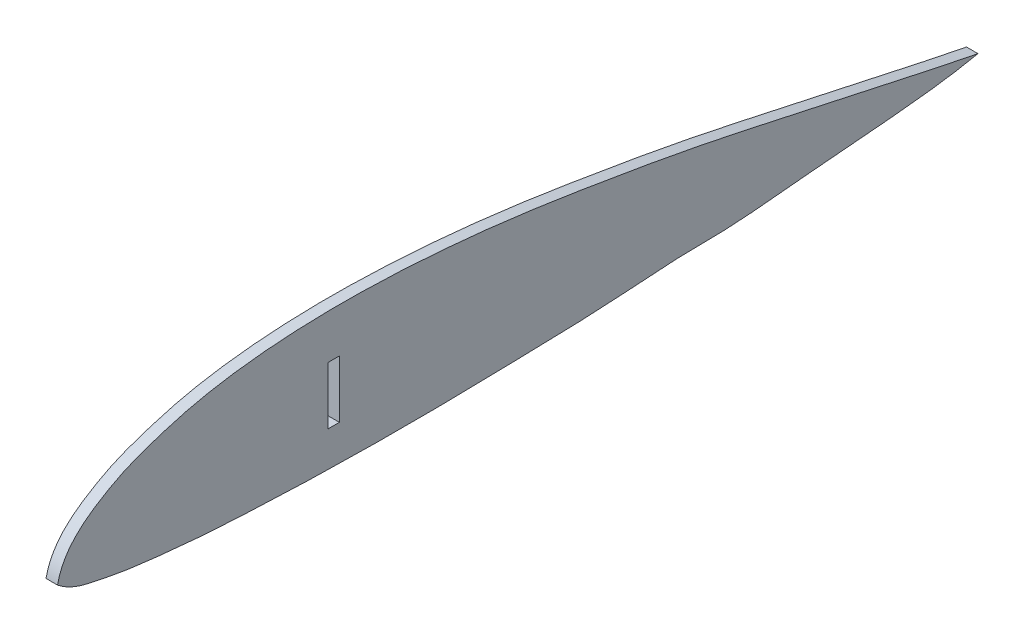
from build123d import *

# Parameters (mm, degrees)
EXTRUDE_1_DEPTH     = 3
SKETCH_2_W          = 3
SKETCH_2_H          = 15
CUT_EXTRUDE_1_DEPTH = 3


with BuildPart() as part:
    # Эскиз1 → Бобышка-Вытянуть1 (new body)
    with BuildSketch(Plane(origin=(0, 0, 0), x_dir=(0, 0, -1), z_dir=(1, 0, 0))):
        with BuildLine():
            add(Edge.make_bspline(
                [(-240, 0), (-238.539586148, 6.885975956), (-231.6119689, 12.33782744), (-222.175332595, 17.412091216), (-214.111867769, 20.343482826), (-204.156129061, 23.263904239), (-188.104616678, 25.89332168), (-168.007150597, 26.960143982), (-143.945589986, 26.026388226), (-119.918298994, 23.567750867), (-95.953760008, 19.758812003), (-71.912657951, 15.561977026), (-48.005978392, 10.220578603), (-23.989791717, 5.171383231), (-8.037469261, 1.523600682), (0, 0)],
                knots=[0, 0, 0, 0, 0.075346011, 0.102327605, 0.127890212, 0.177564304, 0.226024831, 0.321726685, 0.417300323, 0.513304723, 0.609920295, 0.706973803, 0.804635001, 0.902346226, 1, 1, 1, 1], degree=3))
            add(Edge.make_bspline(
                [(-240, 0), (-236.52391179, -2.886637123), (-230.220810861, -4.067786061), (-222.028601874, -5.648779907), (-214.009642515, -6.608514015), (-204.019456847, -7.65058139), (-188.010543644, -8.621004369), (-168.008371033, -9.355028053), (-143.997445941, -9.544655848), (-119.996434598, -9.000571646), (-95.984120714, -8.452313319), (-79.444451482, -6.861549256), (-63.412851028, -6.941357818), (-47.421480018, -5.149296578), (-23.951991061, -3.34616289), (-7.916011456, -1.672238148), (0, 0)],
                knots=[0, 0, 0, 0, 0.053475274, 0.07870931, 0.103753204, 0.153672751, 0.203448049, 0.302856431, 0.40219897, 0.501554025, 0.600954522, 0.700430481, 0.707480416, 0.799996455, 0.899715685, 1, 1, 1, 1], degree=3))
        make_face()
    extrude(amount=EXTRUDE_1_DEPTH)

    # Эскиз2 → Вырез-Вытянуть1 (cut)
    with BuildSketch(Plane.ZY):
        with Locations((168, 7.5)):
            Rectangle(SKETCH_2_W, SKETCH_2_H)
    extrude(amount=-CUT_EXTRUDE_1_DEPTH, mode=Mode.SUBTRACT)


solid = part.part
